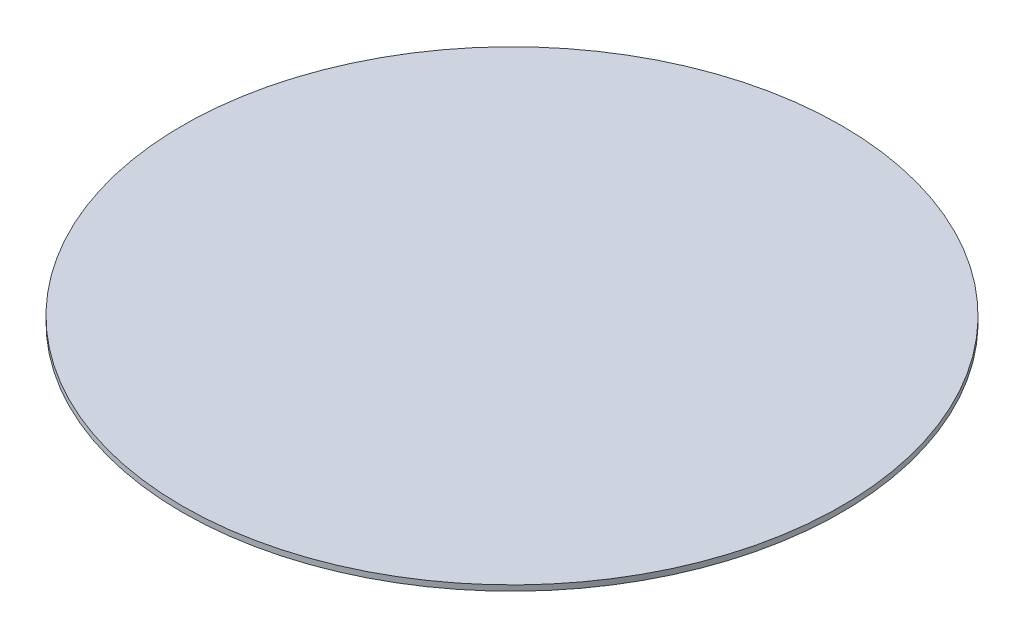
from build123d import *

# Parameters (mm, degrees)
SKETCH2_R           = 304.8
BOSS_EXTRUDE1_DEPTH = 5.08


with BuildPart() as part:
    # Sketch2 → Boss-Extrude1 (new body)
    with BuildSketch(Plane(origin=(0, 0, 0), x_dir=(1, 0, 0), z_dir=(0, 1, 0))):
        with Locations(Location((0, 0, 0), (0, 0, 270))):
            Circle(SKETCH2_R)
    extrude(amount=BOSS_EXTRUDE1_DEPTH)


solid = part.part
